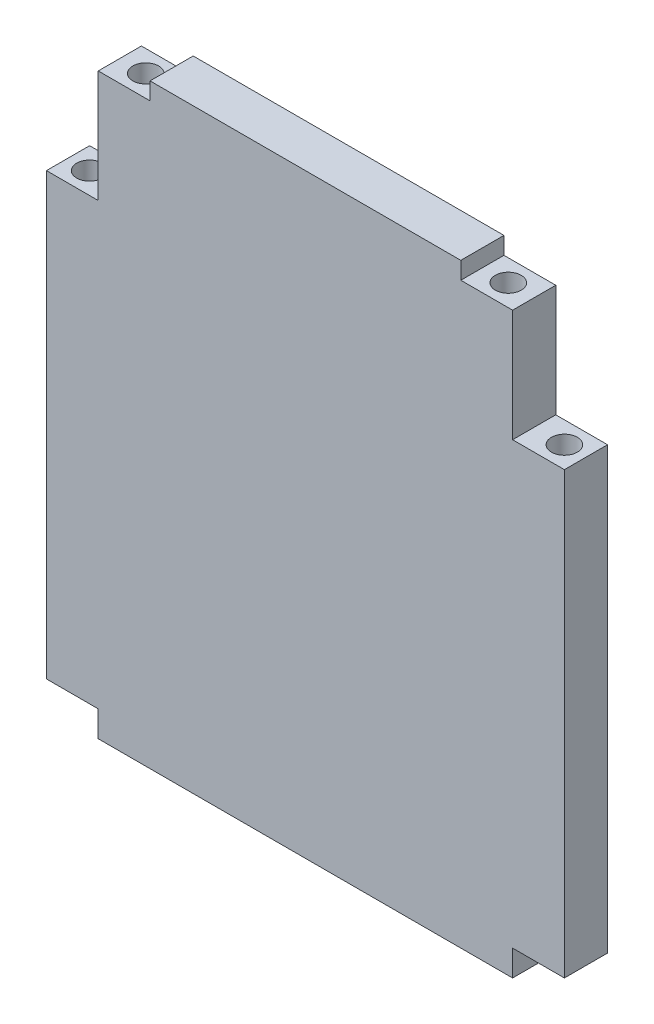
from build123d import *

# Parameters (mm, degrees)
EXTRUDE_1_DEPTH     = 5
SKETCH_2_R          = 1.5
CUT_EXTRUDE_1_DEPTH = 10
SKETCH_3_R          = 1.5
CUT_EXTRUDE_2_DEPTH = 10


with BuildPart() as part:
    # ｽｹｯﾁ1 → ﾎﾞｽ - 押し出し1 (new body)
    with BuildSketch(Plane.XY):
        Polygon((30, -25.5), (30, 25.5), (24, 25.5), (24, 38.5), (18, 38.5), (18, 40.5), (-18, 40.5), (-18, 38.5), (-24, 38.5), (-24, 25.5), (-30, 25.5), (-30, -25.5), (-24, -25.5), (-24, -28.5), (24, -28.5), (24, -25.5), align=None)
    extrude(amount=EXTRUDE_1_DEPTH)

    # ｽｹｯﾁ2 → ｶｯﾄ - 押し出し1 (cut)
    with BuildSketch(Plane(origin=(0, 25.5, 0), x_dir=(1, 0, 0), z_dir=(0, 1, 0))):
        with Locations(Location((-27.5, -2.5, 0), (0, 0, 180))):
            Circle(SKETCH_2_R)
        with Locations((27.5, -2.5)):
            Circle(SKETCH_2_R)
    cut_extrude_1 = extrude(amount=-CUT_EXTRUDE_1_DEPTH, mode=Mode.SUBTRACT)

    # ﾐﾗｰ1: ｶｯﾄ - 押し出し1 across plane
    add(cut_extrude_1.mirror(Plane.ZX), mode=Mode.SUBTRACT)

    # ｽｹｯﾁ3 → ｶｯﾄ - 押し出し2 (cut)
    with BuildSketch(Plane(origin=(0, 38.5, 0), x_dir=(1, 0, 0), z_dir=(0, 1, 0))):
        with Locations(Location((-21, -2.5, 0), (0, 0, 270))):
            Circle(SKETCH_3_R)
        with Locations(Location((21, -2.5, 0), (0, 0, 90))):
            Circle(SKETCH_3_R)
    extrude(amount=-CUT_EXTRUDE_2_DEPTH, mode=Mode.SUBTRACT)


solid = part.part
